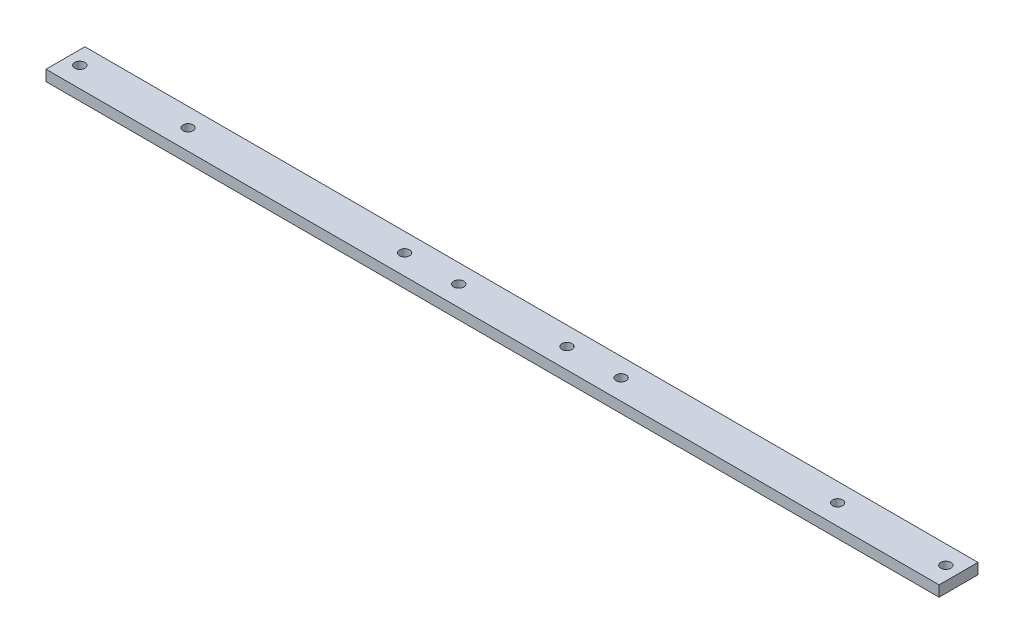
from build123d import *

# Parameters (mm, degrees)
SKETCH1_R           = 1.5
SKETCH1_R_2         = 2
BOSS_EXTRUDE1_DEPTH = 3.175
SKETCH2_R           = 1.5
CUT_EXTRUDE1_DEPTH  = 10
SKETCH3_W           = 264
SKETCH3_H           = 13.5
CUT_EXTRUDE2_DEPTH  = 10
SKETCH4_W           = 264
SKETCH4_H           = 2
CUT_EXTRUDE3_DEPTH  = 10


with BuildPart() as part:
    # Sketch1 → Boss-Extrude1 (new body)
    with BuildSketch(Plane(origin=(0, 0, 0), x_dir=(1, 0, 0), z_dir=(0, 1, 0))):
        Polygon((0, -1.464365857), (264, -1.464365857), (264, 4.535634143), (264, 25.535634143), (0, 25.535634143), align=None)
        with Locations(Location((4, 4.535634143, 0), (0, 0, 270))):
            Circle(SKETCH1_R, mode=Mode.SUBTRACT)
        with Locations(Location((36, 4.535634143, 0), (0, 0, 270))):
            Circle(SKETCH1_R, mode=Mode.SUBTRACT)
        with Locations(Location((228, 4.535634143, 0), (0, 0, 270))):
            Circle(SKETCH1_R, mode=Mode.SUBTRACT)
        with Locations(Location((260, 4.535634143, 0), (0, 0, 270))):
            Circle(SKETCH1_R, mode=Mode.SUBTRACT)
        with Locations(Location((68, 21.535634143, 0), (0, 0, 270))):
            Circle(SKETCH1_R_2, mode=Mode.SUBTRACT)
        with Locations(Location((100, 21.535634143, 0), (0, 0, 270))):
            Circle(SKETCH1_R_2, mode=Mode.SUBTRACT)
        with Locations(Location((132, 21.535634143, 0), (0, 0, 270))):
            Circle(SKETCH1_R_2, mode=Mode.SUBTRACT)
        with Locations(Location((164, 21.535634143, 0), (0, 0, 270))):
            Circle(SKETCH1_R_2, mode=Mode.SUBTRACT)
        with Locations(Location((196, 21.535634143, 0), (0, 0, 270))):
            Circle(SKETCH1_R_2, mode=Mode.SUBTRACT)
    extrude(amount=BOSS_EXTRUDE1_DEPTH)

    # Sketch2 → Cut-Extrude1 (cut)
    with BuildSketch(Plane(origin=(0, 3.175, 0), x_dir=(1, 0, 0), z_dir=(0, 1, 0))):
        with Locations(Location((116, 4.535634143, 0), (0, 0, 270))):
            Circle(SKETCH2_R)
        with Locations(Location((148, 4.535634143, 0), (0, 0, 270))):
            Circle(SKETCH2_R)
        with Locations(Location((100, 4.535634143, 0), (0, 0, 270))):
            Circle(SKETCH2_R)
        with Locations(Location((164, 4.535634143, 0), (0, 0, 270))):
            Circle(SKETCH2_R)
    extrude(amount=-CUT_EXTRUDE1_DEPTH, mode=Mode.SUBTRACT)

    # Sketch3 → Cut-Extrude2 (cut)
    with BuildSketch(Plane(origin=(0, 3.175, 0), x_dir=(1, 0, 0), z_dir=(0, 1, 0))):
        with Locations((132, 18.785634143)):
            Rectangle(SKETCH3_W, SKETCH3_H)
    extrude(amount=-CUT_EXTRUDE2_DEPTH, mode=Mode.SUBTRACT)

    # Sketch4 → Cut-Extrude3 (cut)
    with BuildSketch(Plane(origin=(0, 3.175, 0), x_dir=(1, 0, 0), z_dir=(0, 1, 0))):
        with Locations((132, 11.035634143)):
            Rectangle(SKETCH4_W, SKETCH4_H)
    extrude(amount=-CUT_EXTRUDE3_DEPTH, mode=Mode.SUBTRACT)


solid = part.part
